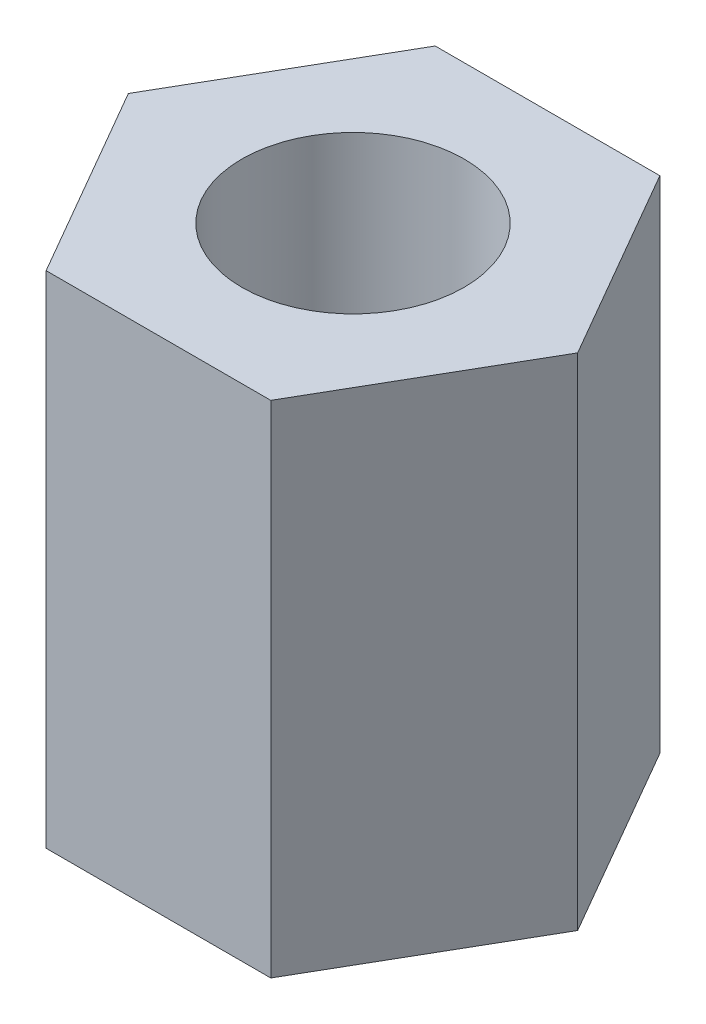
from build123d import *

# Parameters (mm, degrees)
SKETCH1_R           = 2
BOSS_EXTRUDE1_DEPTH = 9


with BuildPart() as part:
    # Sketch1 → Boss-Extrude1 (new body)
    with BuildSketch(Plane(origin=(0, 0, 0), x_dir=(1, 0, 0), z_dir=(0, 1, 0))):
        Polygon((4.041451884, 0), (2.020725942, 3.5), (-2.020725942, 3.5), (-4.041451884, 0), (-2.020725942, -3.5), (2.020725942, -3.5), align=None)
        with Locations(Location((0, 0, 0), (0, 0, 270))):
            Circle(SKETCH1_R, mode=Mode.SUBTRACT)
    extrude(amount=BOSS_EXTRUDE1_DEPTH)


solid = part.part
